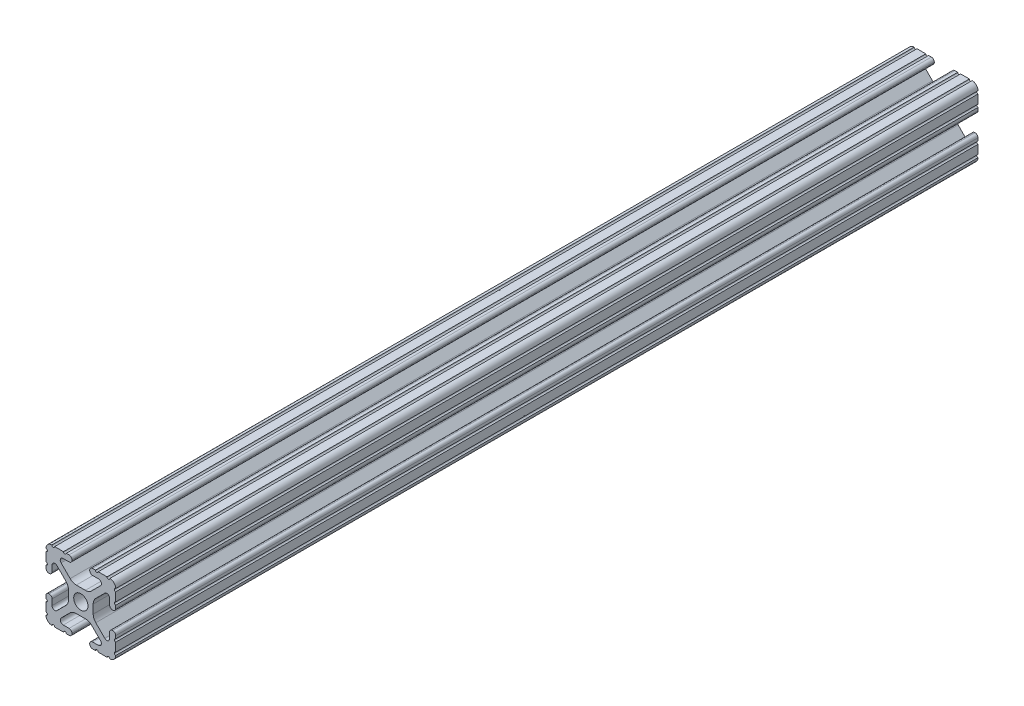
from build123d import *

# Parameters (mm, degrees)
SKETCH1_R           = 2.6035
BOSS_EXTRUDE1_DEPTH = 157.1625


with BuildPart() as part:
    # Sketch1 → Boss-Extrude1 (new, symmetric)
    with BuildSketch(Plane.XY):
        with BuildLine():
            Line((-7.179650497, -8.645192506), (-3.952270251, -5.423690499))
            ThreePointArc((-3.952270251, -5.423690499), (-2.922936451, -4.736929036), (-1.709253557, -4.4958))
            Line((-1.709253557, -4.4958), (1.709253557, -4.4958))
            ThreePointArc((1.709253557, -4.4958), (2.922936451, -4.736929036), (3.952270251, -5.423690499))
            Line((3.952270251, -5.423690499), (7.179650497, -8.645192506))
            ThreePointArc((7.179650497, -8.645192506), (7.41473083, -9.822813117), (6.416408329, -10.4902))
            Line((6.416408329, -10.4902), (4.287512407, -10.4902))
            ThreePointArc((4.287512407, -10.4902), (3.54574862, -10.79744862), (3.2385, -11.539212407))
            Line((3.2385, -11.539212407), (3.2385, -11.650987593))
            ThreePointArc((3.2385, -11.650987593), (3.54574862, -12.39275138), (4.287512407, -12.7))
            Line((4.287512407, -12.7), (5.317126718, -12.7))
            ThreePointArc((5.317126718, -12.7), (5.825126718, -12.192), (6.333126718, -12.7))
            Line((6.333126718, -12.7), (9.550443118, -12.7))
            ThreePointArc((9.550443118, -12.7), (10.058366869, -12.192000006), (10.566443095, -12.699847501))
            ThreePointArc((10.566443095, -12.699847501), (12.082537762, -12.08250727), (12.699846982, -10.566399977))
            ThreePointArc((12.699846982, -10.566399977), (12.192000006, -10.058323491), (12.7, -9.5504))
            Line((12.7, -9.5504), (12.7, -6.3330836))
            ThreePointArc((12.7, -6.3330836), (12.192, -5.8250836), (12.7, -5.3170836))
            Line((12.7, -5.3170836), (12.7, -4.287469289))
            ThreePointArc((12.7, -4.287469289), (12.39275138, -3.545705502), (11.650987593, -3.238456882))
            Line((11.650987593, -3.238456882), (11.539212407, -3.238456882))
            ThreePointArc((11.539212407, -3.238456882), (10.79744862, -3.545705502), (10.4902, -4.287469289))
            Line((10.4902, -4.287469289), (10.4902, -6.402089023))
            ThreePointArc((10.4902, -6.402089023), (9.856505071, -7.351067942), (8.737131347, -7.129408934))
            Line((8.737131347, -7.129408934), (5.441005833, -3.840816462))
            ThreePointArc((5.441005833, -3.840816462), (4.750877967, -2.809883091), (4.5085, -1.593185507))
            Line((4.5085, -1.593185507), (4.5085, 1.593185507))
            ThreePointArc((4.5085, 1.593185507), (4.750877967, 2.809883091), (5.441005833, 3.840816462))
            Line((5.441005833, 3.840816462), (8.737131347, 7.129408934))
            ThreePointArc((8.737131347, 7.129408934), (9.856505071, 7.351067942), (10.4902, 6.402089023))
            Line((10.4902, 6.402089023), (10.4902, 4.287469289))
            ThreePointArc((10.4902, 4.287469289), (10.79744862, 3.545705502), (11.539212407, 3.238456882))
            Line((11.539212407, 3.238456882), (11.650987593, 3.238456882))
            ThreePointArc((11.650987593, 3.238456882), (12.39275138, 3.545705502), (12.7, 4.287469289))
            Line((12.7, 4.287469289), (12.7, 5.3170836))
            ThreePointArc((12.7, 5.3170836), (12.192, 5.8250836), (12.7, 6.3330836))
            Line((12.7, 6.3330836), (12.7, 9.5504))
            ThreePointArc((12.7, 9.5504), (12.192000006, 10.058323491), (12.699846982, 10.566399977))
            ThreePointArc((12.699846982, 10.566399977), (12.082537762, 12.08250727), (10.566443095, 12.699847501))
            ThreePointArc((10.566443095, 12.699847501), (10.058366869, 12.192000006), (9.550443118, 12.7))
            Line((9.550443118, 12.7), (6.333126718, 12.7))
            ThreePointArc((6.333126718, 12.7), (5.825126718, 12.192), (5.317126718, 12.7))
            Line((5.317126718, 12.7), (4.287512407, 12.7))
            ThreePointArc((4.287512407, 12.7), (3.54574862, 12.39275138), (3.2385, 11.650987593))
            Line((3.2385, 11.650987593), (3.2385, 11.539212407))
            ThreePointArc((3.2385, 11.539212407), (3.54574862, 10.79744862), (4.287512407, 10.4902))
            Line((4.287512407, 10.4902), (6.476788598, 10.4902))
            ThreePointArc((6.476788598, 10.4902), (7.432222385, 9.85140422), (7.207036008, 8.724370562))
            Line((7.207036008, 8.724370562), (3.898272566, 5.423169045))
            ThreePointArc((3.898272566, 5.423169045), (2.869120213, 4.736787962), (1.655778399, 4.4958))
            Line((1.655778399, 4.4958), (-1.655778399, 4.4958))
            ThreePointArc((-1.655778399, 4.4958), (-2.869120213, 4.736787962), (-3.898272566, 5.423169045))
            Line((-3.898272566, 5.423169045), (-7.207036008, 8.724370562))
            ThreePointArc((-7.207036008, 8.724370562), (-7.432222385, 9.85140422), (-6.476788598, 10.4902))
            Line((-6.476788598, 10.4902), (-4.287512407, 10.4902))
            ThreePointArc((-4.287512407, 10.4902), (-3.54574862, 10.79744862), (-3.2385, 11.539212407))
            Line((-3.2385, 11.539212407), (-3.2385, 11.650987593))
            ThreePointArc((-3.2385, 11.650987593), (-3.54574862, 12.39275138), (-4.287512407, 12.7))
            Line((-4.287512407, 12.7), (-5.317126718, 12.7))
            ThreePointArc((-5.317126718, 12.7), (-5.825126718, 12.192), (-6.333126718, 12.7))
            Line((-6.333126718, 12.7), (-9.550443118, 12.7))
            ThreePointArc((-9.550443118, 12.7), (-10.058366869, 12.192000006), (-10.566443095, 12.699847501))
            ThreePointArc((-10.566443095, 12.699847501), (-12.082537762, 12.08250727), (-12.699846982, 10.566399977))
            ThreePointArc((-12.699846982, 10.566399977), (-12.192000006, 10.058323491), (-12.7, 9.5504))
            Line((-12.7, 9.5504), (-12.7, 6.3330836))
            ThreePointArc((-12.7, 6.3330836), (-12.192, 5.8250836), (-12.7, 5.3170836))
            Line((-12.7, 5.3170836), (-12.7, 4.287469289))
            ThreePointArc((-12.7, 4.287469289), (-12.39275138, 3.545705502), (-11.650987593, 3.238456882))
            Line((-11.650987593, 3.238456882), (-11.539212407, 3.238456882))
            ThreePointArc((-11.539212407, 3.238456882), (-10.79744862, 3.545705502), (-10.4902, 4.287469289))
            Line((-10.4902, 4.287469289), (-10.4902, 6.402089023))
            ThreePointArc((-10.4902, 6.402089023), (-9.856505071, 7.351067942), (-8.737131347, 7.129408934))
            Line((-8.737131347, 7.129408934), (-5.441005833, 3.840816462))
            ThreePointArc((-5.441005833, 3.840816462), (-4.750877967, 2.809883091), (-4.5085, 1.593185507))
            Line((-4.5085, 1.593185507), (-4.5085, -1.593185507))
            ThreePointArc((-4.5085, -1.593185507), (-4.750877967, -2.809883091), (-5.441005833, -3.840816462))
            Line((-5.441005833, -3.840816462), (-8.737131347, -7.129408934))
            ThreePointArc((-8.737131347, -7.129408934), (-9.856505071, -7.351067942), (-10.4902, -6.402089023))
            Line((-10.4902, -6.402089023), (-10.4902, -4.287469289))
            ThreePointArc((-10.4902, -4.287469289), (-10.79744862, -3.545705502), (-11.539212407, -3.238456882))
            Line((-11.539212407, -3.238456882), (-11.650987593, -3.238456882))
            ThreePointArc((-11.650987593, -3.238456882), (-12.39275138, -3.545705502), (-12.7, -4.287469289))
            Line((-12.7, -4.287469289), (-12.7, -5.3170836))
            ThreePointArc((-12.7, -5.3170836), (-12.192, -5.8250836), (-12.7, -6.3330836))
            Line((-12.7, -6.3330836), (-12.7, -9.5504))
            ThreePointArc((-12.7, -9.5504), (-12.192000006, -10.058323491), (-12.699846982, -10.566399977))
            ThreePointArc((-12.699846982, -10.566399977), (-12.082537762, -12.08250727), (-10.566443095, -12.699847501))
            ThreePointArc((-10.566443095, -12.699847501), (-10.058366869, -12.192000006), (-9.550443118, -12.7))
            Line((-9.550443118, -12.7), (-6.333126718, -12.7))
            ThreePointArc((-6.333126718, -12.7), (-5.825126718, -12.192), (-5.317126718, -12.7))
            Line((-5.317126718, -12.7), (-4.287512407, -12.7))
            ThreePointArc((-4.287512407, -12.7), (-3.54574862, -12.39275138), (-3.2385, -11.650987593))
            Line((-3.2385, -11.650987593), (-3.2385, -11.539212407))
            ThreePointArc((-3.2385, -11.539212407), (-3.54574862, -10.79744862), (-4.287512407, -10.4902))
            Line((-4.287512407, -10.4902), (-6.416408329, -10.4902))
            ThreePointArc((-6.416408329, -10.4902), (-7.41473083, -9.822813117), (-7.179650497, -8.645192506))
        make_face()
        Circle(SKETCH1_R, mode=Mode.SUBTRACT)
    extrude(amount=BOSS_EXTRUDE1_DEPTH, both=True)


solid = part.part
